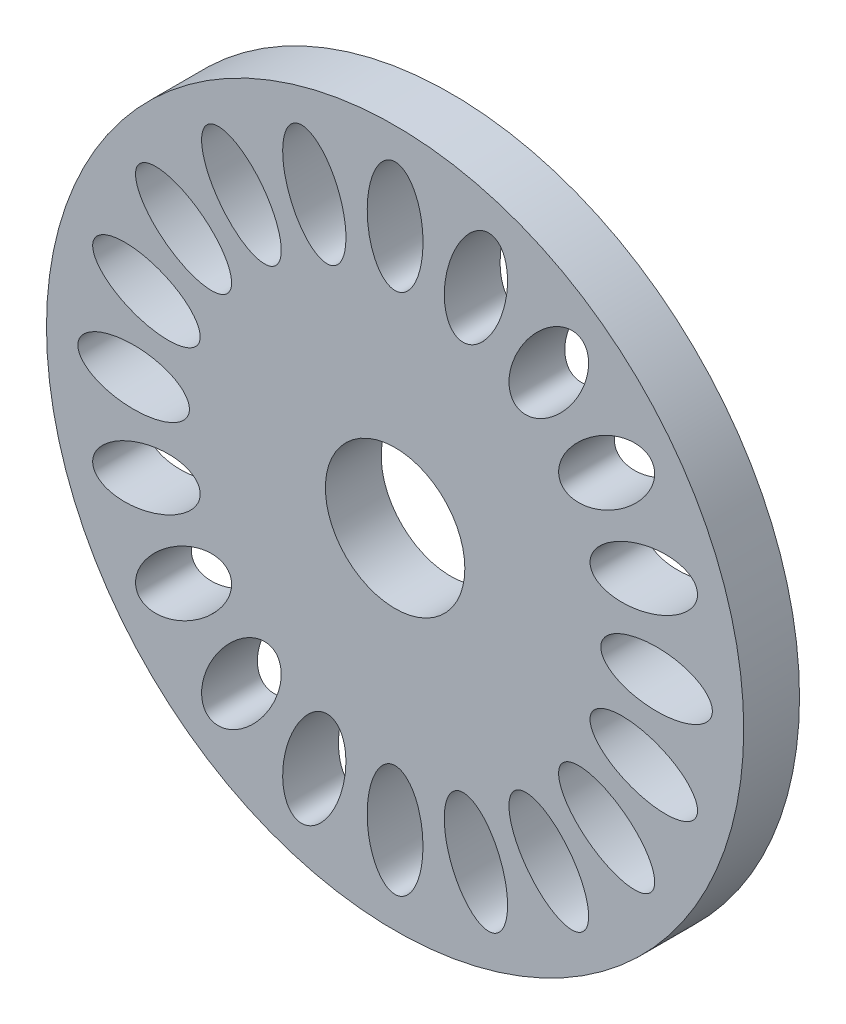
from build123d import *

# Parameters (mm, degrees)
SKETCH1_R           = 12.5
SKETCH1_R_2         = 2.5
SKETCH1_RX          = 2
SKETCH1_RY          = 1
BOSS_EXTRUDE1_DEPTH = 2


with BuildPart() as part:
    # Sketch1 → Boss-Extrude1 (new body)
    with BuildSketch(Plane.XY):
        Circle(SKETCH1_R)
        Circle(SKETCH1_R_2, mode=Mode.SUBTRACT)
        with Locations(Location((0, 9.375), (0, 0, -90))):
            Ellipse(SKETCH1_RX, SKETCH1_RY, mode=Mode.SUBTRACT)
        with Locations(Location((2.897034322, 8.91615484), (0, 0, 72))):
            Ellipse(SKETCH1_RX, SKETCH1_RY, mode=Mode.SUBTRACT)
        with Locations(Location((5.51048674, 7.584534322), (0, 0, 54))):
            Ellipse(SKETCH1_RX, SKETCH1_RY, mode=Mode.SUBTRACT)
        with Locations(Location((7.584534322, 5.51048674), (0, 0, -144))):
            Ellipse(SKETCH1_RX, SKETCH1_RY, mode=Mode.SUBTRACT)
        with Locations(Location((8.91615484, 2.897034322), (0, 0, 18))):
            Ellipse(SKETCH1_RX, SKETCH1_RY, mode=Mode.SUBTRACT)
        with Locations(Location((9.375, 0), (0, 0, 180))):
            Ellipse(SKETCH1_RX, SKETCH1_RY, mode=Mode.SUBTRACT)
        with Locations(Location((8.91615484, -2.897034322), (0, 0, -18))):
            Ellipse(SKETCH1_RX, SKETCH1_RY, mode=Mode.SUBTRACT)
        with Locations(Location((7.584534322, -5.51048674), (0, 0, -36))):
            Ellipse(SKETCH1_RX, SKETCH1_RY, mode=Mode.SUBTRACT)
        with Locations(Location((5.51048674, -7.584534322), (0, 0, 126))):
            Ellipse(SKETCH1_RX, SKETCH1_RY, mode=Mode.SUBTRACT)
        with Locations(Location((2.897034322, -8.91615484), (0, 0, 108))):
            Ellipse(SKETCH1_RX, SKETCH1_RY, mode=Mode.SUBTRACT)
        with Locations(Location((0, -9.375), (0, 0, 90))):
            Ellipse(SKETCH1_RX, SKETCH1_RY, mode=Mode.SUBTRACT)
        with Locations(Location((-2.897034322, -8.91615484), (0, 0, 72))):
            Ellipse(SKETCH1_RX, SKETCH1_RY, mode=Mode.SUBTRACT)
        with Locations(Location((-5.51048674, -7.584534322), (0, 0, 54))):
            Ellipse(SKETCH1_RX, SKETCH1_RY, mode=Mode.SUBTRACT)
        with Locations(Location((-7.584534322, -5.51048674), (0, 0, -144))):
            Ellipse(SKETCH1_RX, SKETCH1_RY, mode=Mode.SUBTRACT)
        with Locations(Location((-8.91615484, -2.897034322), (0, 0, 18))):
            Ellipse(SKETCH1_RX, SKETCH1_RY, mode=Mode.SUBTRACT)
        with Locations(Location((-9.375, 0), (0, 0, 0))):
            Ellipse(SKETCH1_RX, SKETCH1_RY, mode=Mode.SUBTRACT)
        with Locations(Location((-8.91615484, 2.897034322), (0, 0, 162))):
            Ellipse(SKETCH1_RX, SKETCH1_RY, mode=Mode.SUBTRACT)
        with Locations(Location((-7.584534322, 5.51048674), (0, 0, -36))):
            Ellipse(SKETCH1_RX, SKETCH1_RY, mode=Mode.SUBTRACT)
        with Locations(Location((-5.51048674, 7.584534322), (0, 0, -54))):
            Ellipse(SKETCH1_RX, SKETCH1_RY, mode=Mode.SUBTRACT)
        with Locations(Location((-2.897034322, 8.91615484), (0, 0, -72))):
            Ellipse(SKETCH1_RX, SKETCH1_RY, mode=Mode.SUBTRACT)
    extrude(amount=BOSS_EXTRUDE1_DEPTH)


solid = part.part
